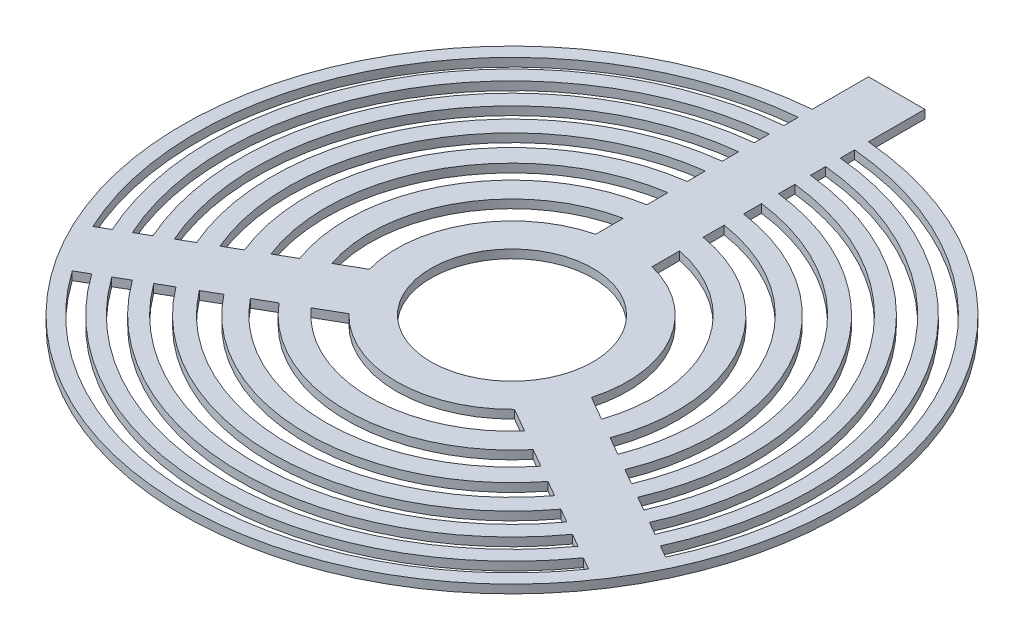
from build123d import *

# Parameters (mm, degrees)
SKETCH_4_R      = 28.77
EXTRUDE_2_DEPTH = 3


with BuildPart() as part:
    # 草图4 → 凸台-拉伸2 (new body)
    with BuildSketch(Plane(origin=(0, 0, 0), x_dir=(1, 0, 0), z_dir=(0, 1, 0))):
        with BuildLine():
            Line((-10, 116.571866246), (-10, 136.571866246))
            Line((-10, 136.571866246), (10, 136.571866246))
            Line((10, 136.571866246), (10, 116.571866246))
            ThreePointArc((10, 116.571866246), (0, -117), (-10, 116.571866246))
        make_face()
        with Locations(Location((0, 0, 0), (0, 0, 270))):
            Circle(SKETCH_4_R, mode=Mode.SUBTRACT)
        with BuildLine():
            Line((-101.67701278, -47.156245315), (-97.293939129, -44.625676563))
            ThreePointArc((-97.293939129, -44.625676563), (-92.699359221, 53.52), (-10, 106.571861202))
            Line((-10, 106.571861202), (-10, 111.632998706))
            ThreePointArc((-10, 111.632998706), (-97.064127256, 56.04), (-101.67701278, -47.156245315))
        make_face(mode=Mode.SUBTRACT)
        with BuildLine():
            Line((-92.787212622, -42.023716801), (-88.138936726, -39.340033461))
            ThreePointArc((-88.138936726, -39.340033461), (-83.588771973, 48.26), (-10, 96.000574998))
            Line((-10, 96.000574998), (-10, 101.367941678))
            ThreePointArc((-10, 101.367941678), (-88.213347629, 50.93), (-92.787212622, -42.023716801))
        make_face(mode=Mode.SUBTRACT)
        with BuildLine():
            Line((-83.331028335, -36.564186257), (-78.318973499, -33.670475049))
            ThreePointArc((-78.318973499, -33.670475049), (-73.828665673, 42.625), (-10, 84.661458173))
            Line((-10, 84.661458173), (-10, 90.44888059))
            ThreePointArc((-10, 90.44888059), (-78.808311744, 45.5), (-83.331028335, -36.564186257))
        make_face(mode=Mode.SUBTRACT)
        with BuildLine():
            Line((-73.075202534, -30.64298247), (-67.527706459, -27.440134118))
            ThreePointArc((-67.527706459, -27.440134118), (-63.124591682, 36.445), (-10, 72.200776312))
            Line((-10, 72.200776312), (-10, 78.606473016))
            ThreePointArc((-10, 78.606473016), (-68.623852996, 39.62), (-73.075202534, -30.64298247))
        make_face(mode=Mode.SUBTRACT)
        with BuildLine():
            Line((-61.58540006, -24.009341919), (-55.118955246, -20.275938265))
            ThreePointArc((-55.118955246, -20.275938265), (-50.861671964, 29.365), (-10, 57.872384606))
            Line((-10, 57.872384606), (-10, 65.339191914))
            ThreePointArc((-10, 65.339191914), (-57.24427919, 33.05), (-61.58540006, -24.009341919))
        make_face(mode=Mode.SUBTRACT)
        with BuildLine():
            Line((-47.885927762, -16.0999479), (-39.407930409, -11.205173846))
            ThreePointArc((-39.407930409, -11.205173846), (-35.481060793, 20.485), (-10, 39.730855767))
            Line((-10, 39.730855767), (-10, 49.520403876))
            ThreePointArc((-10, 49.520403876), (-43.751603399, 25.26), (-47.885927762, -16.0999479))
        make_face(mode=Mode.SUBTRACT)
        with BuildLine():
            Line((-37.885927762, -33.420455976), (-29.407930409, -28.525681921))
            ThreePointArc((-29.407930409, -28.525681921), (0, -40.97), (29.407930409, -28.525681921))
            Line((29.407930409, -28.525681921), (37.885927762, -33.420455976))
            ThreePointArc((37.885927762, -33.420455976), (0, -50.52), (-37.885927762, -33.420455976))
        make_face(mode=Mode.SUBTRACT)
        with BuildLine():
            Line((-51.58540006, -41.329849995), (-45.118955246, -37.596446341))
            ThreePointArc((-45.118955246, -37.596446341), (0, -58.73), (45.118955246, -37.596446341))
            Line((45.118955246, -37.596446341), (51.58540006, -41.329849995))
            ThreePointArc((51.58540006, -41.329849995), (0, -66.1), (-51.58540006, -41.329849995))
        make_face(mode=Mode.SUBTRACT)
        with BuildLine():
            Line((-63.075202534, -47.963490546), (-57.527706459, -44.760642194))
            ThreePointArc((-57.527706459, -44.760642194), (0, -72.89), (57.527706459, -44.760642194))
            Line((57.527706459, -44.760642194), (63.075202534, -47.963490546))
            ThreePointArc((63.075202534, -47.963490546), (0, -79.24), (-63.075202534, -47.963490546))
        make_face(mode=Mode.SUBTRACT)
        with BuildLine():
            Line((-82.787212622, -59.344224877), (-78.138936726, -56.660541537))
            ThreePointArc((-78.138936726, -56.660541537), (0, -96.52), (78.138936726, -56.660541537))
            Line((78.138936726, -56.660541537), (82.787212622, -59.344224877))
            ThreePointArc((82.787212622, -59.344224877), (0, -101.86), (-82.787212622, -59.344224877))
        make_face(mode=Mode.SUBTRACT)
        with BuildLine():
            Line((-73.331028335, -53.884694333), (-68.318973499, -50.990983124))
            ThreePointArc((-68.318973499, -50.990983124), (0, -85.25), (68.318973499, -50.990983124))
            Line((68.318973499, -50.990983124), (73.331028335, -53.884694333))
            ThreePointArc((73.331028335, -53.884694333), (0, -91), (-73.331028335, -53.884694333))
        make_face(mode=Mode.SUBTRACT)
        with BuildLine():
            Line((-91.67701278, -64.476753391), (-87.293939129, -61.946184639))
            ThreePointArc((-87.293939129, -61.946184639), (0, -107.04), (87.293939129, -61.946184639))
            Line((87.293939129, -61.946184639), (91.67701278, -64.476753391))
            ThreePointArc((91.67701278, -64.476753391), (0, -112.08), (-91.67701278, -64.476753391))
        make_face(mode=Mode.SUBTRACT)
        with BuildLine():
            Line((10, 49.520403876), (10, 39.730855767))
            ThreePointArc((10, 39.730855767), (35.481060793, 20.485), (39.407930409, -11.205173846))
            Line((39.407930409, -11.205173846), (47.885927762, -16.0999479))
            ThreePointArc((47.885927762, -16.0999479), (43.751603399, 25.26), (10, 49.520403876))
        make_face(mode=Mode.SUBTRACT)
        with BuildLine():
            Line((10, 65.339191914), (10, 57.872384606))
            ThreePointArc((10, 57.872384606), (50.861671964, 29.365), (55.118955246, -20.275938265))
            Line((55.118955246, -20.275938265), (61.58540006, -24.009341919))
            ThreePointArc((61.58540006, -24.009341919), (57.24427919, 33.05), (10, 65.339191914))
        make_face(mode=Mode.SUBTRACT)
        with BuildLine():
            Line((10, 78.606473016), (10, 72.200776312))
            ThreePointArc((10, 72.200776312), (63.124591682, 36.445), (67.527706459, -27.440134118))
            Line((67.527706459, -27.440134118), (73.075202534, -30.64298247))
            ThreePointArc((73.075202534, -30.64298247), (68.623852996, 39.62), (10, 78.606473016))
        make_face(mode=Mode.SUBTRACT)
        with BuildLine():
            Line((10, 90.44888059), (10, 84.661458173))
            ThreePointArc((10, 84.661458173), (73.828665673, 42.625), (78.318973499, -33.670475049))
            Line((78.318973499, -33.670475049), (83.331028335, -36.564186257))
            ThreePointArc((83.331028335, -36.564186257), (78.808311744, 45.5), (10, 90.44888059))
        make_face(mode=Mode.SUBTRACT)
        with BuildLine():
            Line((10, 101.367941678), (10, 96.000574998))
            ThreePointArc((10, 96.000574998), (83.588771973, 48.26), (88.138936726, -39.340033461))
            Line((88.138936726, -39.340033461), (92.787212622, -42.023716801))
            ThreePointArc((92.787212622, -42.023716801), (88.213347629, 50.93), (10, 101.367941678))
        make_face(mode=Mode.SUBTRACT)
        with BuildLine():
            Line((10, 111.632998706), (10, 106.571861202))
            ThreePointArc((10, 106.571861202), (92.699359221, 53.52), (97.293939129, -44.625676563))
            Line((97.293939129, -44.625676563), (101.67701278, -47.156245315))
            ThreePointArc((101.67701278, -47.156245315), (97.064127256, 56.04), (10, 111.632998706))
        make_face(mode=Mode.SUBTRACT)
    extrude(amount=EXTRUDE_2_DEPTH)


solid = part.part
